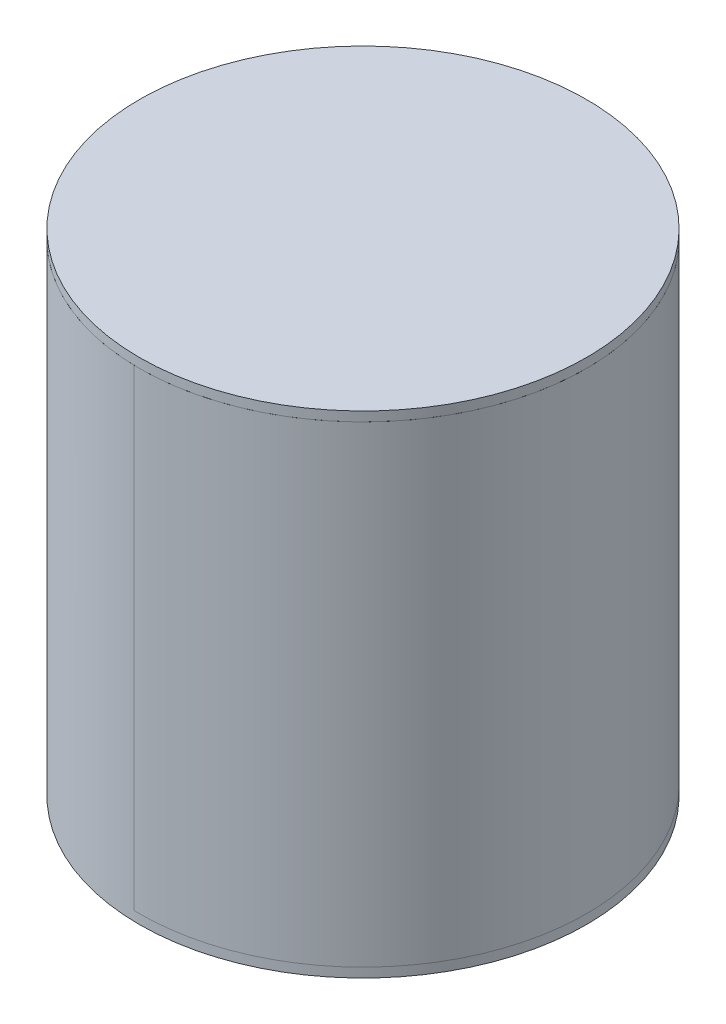
from build123d import *

# Parameters (mm, degrees)
SKETCH_474_R        = 68
EXTRUDE_7_DEPTH     = 3
EXTRUDE_START       = 3
EXTRUDE_8_DEPTH     = 150
EXTRUDE_9_DEPTH     = 150
CUT_EXTRUDE_START   = -5
SKETCH_7_R          = 69.5
CUT_EXTRUDE_2_DEPTH = 5
SKETCH_8_R          = 71
SKETCH_8_R_2        = 69.5
EXTRUDE_11_DEPTH    = 3
EXTRUDE_START_2     = -5
EXTRUDE_14_DEPTH    = 8
SHELL_4_T           = -1


with BuildPart() as part:
    # Sketch 474 → 填料-伸長7 (new body)
    with BuildSketch(Plane(origin=(0, 0, 0), x_dir=(1, 0, 0), z_dir=(0, 1, 0))):
        Circle(SKETCH_474_R)
        with BuildLine():
            ThreePointArc((1.676303744, 69.479781273), (0, 69.5), (-1.676303744, 69.479781273))
            Line((-1.676303744, 69.479781273), (-1.712482962, 70.979344898))
            ThreePointArc((-1.712482962, 70.979344898), (-71, 0), (-1.712482962, -70.979344898))
            Line((-1.712482962, -70.979344898), (-1.676303744, -69.479781273))
            ThreePointArc((-1.676303744, -69.479781273), (0, -69.5), (1.676303744, -69.479781273))
            Line((1.676303744, -69.479781273), (1.640124527, -67.980217648))
            ThreePointArc((1.640124527, -67.980217648), (-68, 0), (1.640124527, 67.980217648))
            Line((1.640124527, 67.980217648), (1.676303744, 69.479781273))
        make_face()
        with BuildLine():
            Line((-1.712482962, 70.979344898), (-1.676303744, 69.479781273))
            ThreePointArc((-1.676303744, 69.479781273), (0, 69.5), (1.676303744, 69.479781273))
            Line((1.676303744, 69.479781273), (1.640124527, 67.980217648))
            ThreePointArc((1.640124527, 67.980217648), (48.6596777, 47.499850169), (68, 0))
            ThreePointArc((68, 0), (48.6596777, -47.499850169), (1.640124527, -67.980217648))
            Line((1.640124527, -67.980217648), (1.676303744, -69.479781273))
            ThreePointArc((1.676303744, -69.479781273), (0, -69.5), (-1.676303744, -69.479781273))
            Line((-1.676303744, -69.479781273), (-1.712482962, -70.979344898))
            ThreePointArc((-1.712482962, -70.979344898), (49.595431794, -50.806428187), (71, 0))
            ThreePointArc((71, 0), (49.595431794, 50.806428187), (-1.712482962, 70.979344898))
        make_face()
    extrude(amount=EXTRUDE_7_DEPTH)

    # 底座<9> → 填料-伸長8 (add)
    with BuildSketch(Plane(origin=(0, 0, 0), x_dir=(1, 0, 0), z_dir=(0, 1, 0)).offset(EXTRUDE_START)):
        with BuildLine():
            ThreePointArc((1.676303744, 69.479781273), (0, 69.5), (-1.676303744, 69.479781273))
            Line((-1.676303744, 69.479781273), (-1.712482962, 70.979344898))
            ThreePointArc((-1.712482962, 70.979344898), (-71, 0), (-1.712482962, -70.979344898))
            Line((-1.712482962, -70.979344898), (-1.676303744, -69.479781273))
            ThreePointArc((-1.676303744, -69.479781273), (0, -69.5), (1.676303744, -69.479781273))
            Line((1.676303744, -69.479781273), (1.640124527, -67.980217648))
            ThreePointArc((1.640124527, -67.980217648), (-68, 0), (1.640124527, 67.980217648))
            Line((1.640124527, 67.980217648), (1.676303744, 69.479781273))
        make_face()
    extrude(amount=EXTRUDE_8_DEPTH)


with BuildPart() as body_2:
    # 底座<10> → 填料-伸長9 (new body)
    with BuildSketch(Plane(origin=(0, 0, 0), x_dir=(1, 0, 0), z_dir=(0, 1, 0)).offset(EXTRUDE_START)):
        with BuildLine():
            Line((-1.712482962, 70.979344898), (-1.676303744, 69.479781273))
            ThreePointArc((-1.676303744, 69.479781273), (0, 69.5), (1.676303744, 69.479781273))
            Line((1.676303744, 69.479781273), (1.640124527, 67.980217648))
            ThreePointArc((1.640124527, 67.980217648), (48.6596777, 47.499850169), (68, 0))
            ThreePointArc((68, 0), (48.6596777, -47.499850169), (1.640124527, -67.980217648))
            Line((1.640124527, -67.980217648), (1.676303744, -69.479781273))
            ThreePointArc((1.676303744, -69.479781273), (0, -69.5), (-1.676303744, -69.479781273))
            Line((-1.676303744, -69.479781273), (-1.712482962, -70.979344898))
            ThreePointArc((-1.712482962, -70.979344898), (49.595431794, -50.806428187), (71, 0))
            ThreePointArc((71, 0), (49.595431794, 50.806428187), (-1.712482962, 70.979344898))
        make_face()
    extrude(amount=EXTRUDE_9_DEPTH)


with BuildPart() as cut_extrude_2_tool:
    # 草圖7 → 除料-伸長2 (new body)
    with BuildSketch(Plane(origin=(0, 153, 0), x_dir=(1, 0, 0), z_dir=(0, 1, 0)).offset(CUT_EXTRUDE_START)):
        Circle(SKETCH_7_R)
    extrude(amount=CUT_EXTRUDE_2_DEPTH)


with BuildPart() as part_1:
    add(part.part)

    # 除料-伸長2: cut by cut_extrude_2_tool
    add(cut_extrude_2_tool.part, mode=Mode.SUBTRACT)


with BuildPart() as body_2_1:
    add(body_2.part)

    # 除料-伸長2: cut by cut_extrude_2_tool
    add(cut_extrude_2_tool.part, mode=Mode.SUBTRACT)


with BuildPart() as body_3:
    # 草圖8 → 填料-伸長11 (new body)
    with BuildSketch(Plane(origin=(0, 153, 0), x_dir=(1, 0, 0), z_dir=(0, 1, 0))):
        with Locations(Location((0, 0, 0), (0, 0, 270))):
            Circle(SKETCH_8_R)
        with Locations(Location((0, 0, 0), (0, 0, 270))):
            Circle(SKETCH_8_R_2, mode=Mode.SUBTRACT)
    extrude(amount=EXTRUDE_11_DEPTH)

    # 草圖8<7> → 填料-伸長14 (add)
    with BuildSketch(Plane(origin=(0, 153, 0), x_dir=(1, 0, 0), z_dir=(0, 1, 0)).offset(EXTRUDE_START_2)):
        with BuildLine():
            ThreePointArc((-1.676303744, -69.479781273), (48.547640982, -49.733052944), (69.5, 0))
            ThreePointArc((69.5, 0), (48.547640982, 49.733052944), (-1.676303744, 69.479781273))
            ThreePointArc((-1.676303744, 69.479781273), (-69.5, 0), (-1.676303744, -69.479781273))
        make_face()
    extrude(amount=EXTRUDE_14_DEPTH)

    # 薄殼4
    shell_4_openings = [body_3.faces().sort_by_distance(p)[0] for p in [
        (0, 148, 0),
    ]]
    offset(amount=SHELL_4_T, openings=shell_4_openings, kind=Kind.INTERSECTION)


solid = Compound([part_1.part, body_2_1.part, body_3.part])
